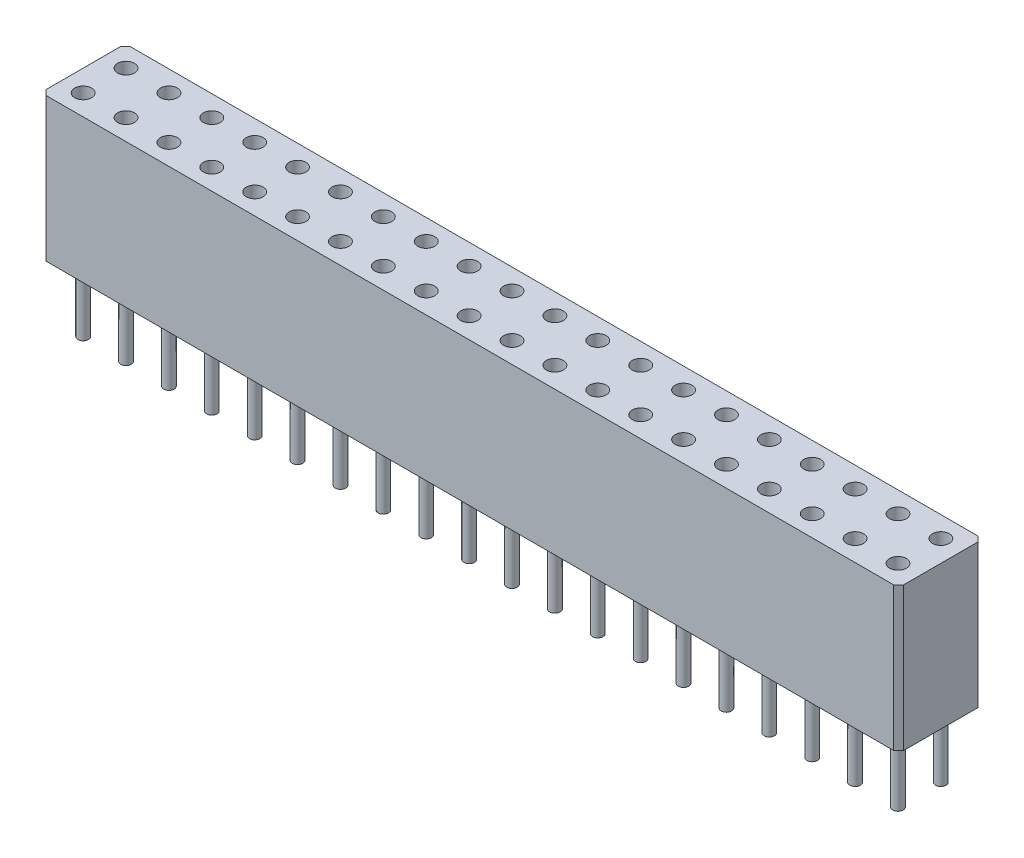
from build123d import *

# Parameters (mm, degrees)
SKETCH_2_R          = 0.31
EXTRUDE_4_DEPTH     = 8.5
SKETCH_7_R          = 0.5
CUT_EXTRUDE_1_DEPTH = 8
SKETCH_8_R          = 0.31
EXTRUDE_5_DEPTH     = 4
EXTRUDE_5_2_DEPTH   = 4
EXTRUDE_5_3_DEPTH   = 4
EXTRUDE_5_4_DEPTH   = 4
EXTRUDE_5_5_DEPTH   = 4
EXTRUDE_5_6_DEPTH   = 4
EXTRUDE_5_7_DEPTH   = 4
EXTRUDE_5_8_DEPTH   = 4
EXTRUDE_5_9_DEPTH   = 4
EXTRUDE_5_10_DEPTH  = 4
EXTRUDE_5_11_DEPTH  = 4
EXTRUDE_5_12_DEPTH  = 4
EXTRUDE_5_13_DEPTH  = 4
EXTRUDE_5_14_DEPTH  = 4
EXTRUDE_5_15_DEPTH  = 4
EXTRUDE_5_16_DEPTH  = 4
EXTRUDE_5_17_DEPTH  = 4
EXTRUDE_5_18_DEPTH  = 4
EXTRUDE_5_19_DEPTH  = 4
EXTRUDE_5_20_DEPTH  = 4
EXTRUDE_5_21_DEPTH  = 4
EXTRUDE_5_22_DEPTH  = 4
EXTRUDE_5_23_DEPTH  = 4
EXTRUDE_5_24_DEPTH  = 4
EXTRUDE_5_25_DEPTH  = 4
EXTRUDE_5_26_DEPTH  = 4
EXTRUDE_5_27_DEPTH  = 4
EXTRUDE_5_28_DEPTH  = 4
EXTRUDE_5_29_DEPTH  = 4
EXTRUDE_5_30_DEPTH  = 4
EXTRUDE_5_31_DEPTH  = 4
EXTRUDE_5_32_DEPTH  = 4
EXTRUDE_5_33_DEPTH  = 4
EXTRUDE_5_34_DEPTH  = 4
EXTRUDE_5_35_DEPTH  = 4
EXTRUDE_5_36_DEPTH  = 4
EXTRUDE_5_37_DEPTH  = 4
EXTRUDE_5_38_DEPTH  = 4
EXTRUDE_5_39_DEPTH  = 4
EXTRUDE_5_40_DEPTH  = 4


with BuildPart() as part:
    # Эскиз2 → Бобышка-Вытянуть4 (new body)
    with BuildSketch(Plane(origin=(0, 0, 0), x_dir=(1, 0, 0), z_dir=(0, 1, 0))):
        Polygon((49.411742563, 15.04372655), (86.911742563, 15.04372655), (87.211742563, 14.74372655), (87.211742563, 10.34372655), (86.911742563, 10.04372655), (49.411742563, 10.04372655), (36.711742563, 10.04372655), (36.411742563, 10.34372655), (36.411742563, 14.74372655), (36.711742563, 15.04372655), align=None)
        with Locations(Location((83.401742563, 11.27372655, 0), (0, 0, 270))):
            Circle(SKETCH_2_R, mode=Mode.SUBTRACT)
        with Locations(Location((80.861742563, 11.27372655, 0), (0, 0, 270))):
            Circle(SKETCH_2_R, mode=Mode.SUBTRACT)
        with Locations(Location((78.321742563, 11.27372655, 0), (0, 0, 270))):
            Circle(SKETCH_2_R, mode=Mode.SUBTRACT)
        with Locations(Location((75.781742563, 11.27372655, 0), (0, 0, 270))):
            Circle(SKETCH_2_R, mode=Mode.SUBTRACT)
        with Locations(Location((73.241742563, 11.27372655, 0), (0, 0, 270))):
            Circle(SKETCH_2_R, mode=Mode.SUBTRACT)
        with Locations(Location((70.701742563, 11.27372655, 0), (0, 0, 270))):
            Circle(SKETCH_2_R, mode=Mode.SUBTRACT)
        with Locations(Location((68.161742563, 11.27372655, 0), (0, 0, 270))):
            Circle(SKETCH_2_R, mode=Mode.SUBTRACT)
        with Locations(Location((65.621742563, 11.27372655, 0), (0, 0, 270))):
            Circle(SKETCH_2_R, mode=Mode.SUBTRACT)
        with Locations(Location((63.081742563, 11.27372655, 0), (0, 0, 270))):
            Circle(SKETCH_2_R, mode=Mode.SUBTRACT)
        with Locations(Location((60.541742563, 11.27372655, 0), (0, 0, 270))):
            Circle(SKETCH_2_R, mode=Mode.SUBTRACT)
        with Locations(Location((58.001742563, 11.27372655, 0), (0, 0, 270))):
            Circle(SKETCH_2_R, mode=Mode.SUBTRACT)
        with Locations(Location((55.461742563, 11.27372655, 0), (0, 0, 270))):
            Circle(SKETCH_2_R, mode=Mode.SUBTRACT)
        with Locations(Location((52.921742563, 11.27372655, 0), (0, 0, 270))):
            Circle(SKETCH_2_R, mode=Mode.SUBTRACT)
        with Locations(Location((50.381742563, 11.27372655, 0), (0, 0, 270))):
            Circle(SKETCH_2_R, mode=Mode.SUBTRACT)
        with Locations(Location((47.841742563, 11.27372655, 0), (0, 0, 270))):
            Circle(SKETCH_2_R, mode=Mode.SUBTRACT)
        with Locations(Location((45.301742563, 11.27372655, 0), (0, 0, 270))):
            Circle(SKETCH_2_R, mode=Mode.SUBTRACT)
        with Locations(Location((42.761742563, 11.27372655, 0), (0, 0, 270))):
            Circle(SKETCH_2_R, mode=Mode.SUBTRACT)
        with Locations(Location((40.221742563, 11.27372655, 0), (0, 0, 270))):
            Circle(SKETCH_2_R, mode=Mode.SUBTRACT)
        with Locations(Location((37.681742563, 11.27372655, 0), (0, 0, 270))):
            Circle(SKETCH_2_R, mode=Mode.SUBTRACT)
        with Locations(Location((83.401742563, 13.81372655, 0), (0, 0, 270))):
            Circle(SKETCH_2_R, mode=Mode.SUBTRACT)
        with Locations(Location((80.861742563, 13.81372655, 0), (0, 0, 270))):
            Circle(SKETCH_2_R, mode=Mode.SUBTRACT)
        with Locations(Location((78.321742563, 13.81372655, 0), (0, 0, 270))):
            Circle(SKETCH_2_R, mode=Mode.SUBTRACT)
        with Locations(Location((75.781742563, 13.81372655, 0), (0, 0, 270))):
            Circle(SKETCH_2_R, mode=Mode.SUBTRACT)
        with Locations(Location((73.241742563, 13.81372655, 0), (0, 0, 270))):
            Circle(SKETCH_2_R, mode=Mode.SUBTRACT)
        with Locations(Location((70.701742563, 13.81372655, 0), (0, 0, 270))):
            Circle(SKETCH_2_R, mode=Mode.SUBTRACT)
        with Locations(Location((68.161742563, 13.81372655, 0), (0, 0, 270))):
            Circle(SKETCH_2_R, mode=Mode.SUBTRACT)
        with Locations(Location((65.621742563, 13.81372655, 0), (0, 0, 270))):
            Circle(SKETCH_2_R, mode=Mode.SUBTRACT)
        with Locations(Location((63.081742563, 13.81372655, 0), (0, 0, 270))):
            Circle(SKETCH_2_R, mode=Mode.SUBTRACT)
        with Locations(Location((60.541742563, 13.81372655, 0), (0, 0, 270))):
            Circle(SKETCH_2_R, mode=Mode.SUBTRACT)
        with Locations(Location((85.941742563, 11.27372655, 0), (0, 0, 270))):
            Circle(SKETCH_2_R, mode=Mode.SUBTRACT)
        with Locations(Location((58.001742563, 13.81372655, 0), (0, 0, 270))):
            Circle(SKETCH_2_R, mode=Mode.SUBTRACT)
        with Locations(Location((55.461742563, 13.81372655, 0), (0, 0, 270))):
            Circle(SKETCH_2_R, mode=Mode.SUBTRACT)
        with Locations(Location((52.921742563, 13.81372655, 0), (0, 0, 270))):
            Circle(SKETCH_2_R, mode=Mode.SUBTRACT)
        with Locations(Location((50.381742563, 13.81372655, 0), (0, 0, 270))):
            Circle(SKETCH_2_R, mode=Mode.SUBTRACT)
        with Locations(Location((47.841742563, 13.81372655, 0), (0, 0, 270))):
            Circle(SKETCH_2_R, mode=Mode.SUBTRACT)
        with Locations(Location((45.301742563, 13.81372655, 0), (0, 0, 270))):
            Circle(SKETCH_2_R, mode=Mode.SUBTRACT)
        with Locations(Location((42.761742563, 13.81372655, 0), (0, 0, 270))):
            Circle(SKETCH_2_R, mode=Mode.SUBTRACT)
        with Locations(Location((40.221742563, 13.81372655, 0), (0, 0, 270))):
            Circle(SKETCH_2_R, mode=Mode.SUBTRACT)
        with Locations(Location((37.681742563, 13.81372655, 0), (0, 0, 270))):
            Circle(SKETCH_2_R, mode=Mode.SUBTRACT)
        with Locations(Location((85.941742563, 13.81372655, 0), (0, 0, 270))):
            Circle(SKETCH_2_R, mode=Mode.SUBTRACT)
    extrude(amount=-EXTRUDE_4_DEPTH)

    # Эскиз7 → Вырез-Вытянуть1 (cut)
    with BuildSketch(Plane(origin=(0, 0, 0), x_dir=(1, 0, 0), z_dir=(0, 1, 0))):
        with Locations(Location((83.401742563, 11.27372655, 0), (0, 0, 270))):
            Circle(SKETCH_7_R)
        with Locations(Location((80.861742563, 11.27372655, 0), (0, 0, 270))):
            Circle(SKETCH_7_R)
        with Locations(Location((78.321742563, 11.27372655, 0), (0, 0, 270))):
            Circle(SKETCH_7_R)
        with Locations(Location((75.781742563, 11.27372655, 0), (0, 0, 270))):
            Circle(SKETCH_7_R)
        with Locations(Location((73.241742563, 11.27372655, 0), (0, 0, 270))):
            Circle(SKETCH_7_R)
        with Locations(Location((70.701742563, 11.27372655, 0), (0, 0, 270))):
            Circle(SKETCH_7_R)
        with Locations(Location((68.161742563, 11.27372655, 0), (0, 0, 270))):
            Circle(SKETCH_7_R)
        with Locations(Location((65.621742563, 11.27372655, 0), (0, 0, 270))):
            Circle(SKETCH_7_R)
        with Locations(Location((63.081742563, 11.27372655, 0), (0, 0, 270))):
            Circle(SKETCH_7_R)
        with Locations(Location((60.541742563, 11.27372655, 0), (0, 0, 270))):
            Circle(SKETCH_7_R)
        with Locations(Location((58.001742563, 11.27372655, 0), (0, 0, 270))):
            Circle(SKETCH_7_R)
        with Locations(Location((55.461742563, 11.27372655, 0), (0, 0, 270))):
            Circle(SKETCH_7_R)
        with Locations(Location((52.921742563, 11.27372655, 0), (0, 0, 270))):
            Circle(SKETCH_7_R)
        with Locations(Location((50.381742563, 11.27372655, 0), (0, 0, 270))):
            Circle(SKETCH_7_R)
        with Locations(Location((47.841742563, 11.27372655, 0), (0, 0, 270))):
            Circle(SKETCH_7_R)
        with Locations(Location((45.301742563, 11.27372655, 0), (0, 0, 270))):
            Circle(SKETCH_7_R)
        with Locations(Location((42.761742563, 11.27372655, 0), (0, 0, 270))):
            Circle(SKETCH_7_R)
        with Locations(Location((40.221742563, 11.27372655, 0), (0, 0, 270))):
            Circle(SKETCH_7_R)
        with Locations(Location((37.681742563, 11.27372655, 0), (0, 0, 270))):
            Circle(SKETCH_7_R)
        with Locations(Location((83.401742563, 13.81372655, 0), (0, 0, 270))):
            Circle(SKETCH_7_R)
        with Locations(Location((80.861742563, 13.81372655, 0), (0, 0, 270))):
            Circle(SKETCH_7_R)
        with Locations(Location((78.321742563, 13.81372655, 0), (0, 0, 270))):
            Circle(SKETCH_7_R)
        with Locations(Location((75.781742563, 13.81372655, 0), (0, 0, 270))):
            Circle(SKETCH_7_R)
        with Locations(Location((73.241742563, 13.81372655, 0), (0, 0, 270))):
            Circle(SKETCH_7_R)
        with Locations(Location((70.701742563, 13.81372655, 0), (0, 0, 270))):
            Circle(SKETCH_7_R)
        with Locations(Location((68.161742563, 13.81372655, 0), (0, 0, 270))):
            Circle(SKETCH_7_R)
        with Locations(Location((65.621742563, 13.81372655, 0), (0, 0, 270))):
            Circle(SKETCH_7_R)
        with Locations(Location((63.081742563, 13.81372655, 0), (0, 0, 270))):
            Circle(SKETCH_7_R)
        with Locations(Location((60.541742563, 13.81372655, 0), (0, 0, 270))):
            Circle(SKETCH_7_R)
        with Locations(Location((85.941742563, 11.27372655, 0), (0, 0, 270))):
            Circle(SKETCH_7_R)
        with Locations(Location((58.001742563, 13.81372655, 0), (0, 0, 270))):
            Circle(SKETCH_7_R)
        with Locations(Location((55.461742563, 13.81372655, 0), (0, 0, 270))):
            Circle(SKETCH_7_R)
        with Locations(Location((52.921742563, 13.81372655, 0), (0, 0, 270))):
            Circle(SKETCH_7_R)
        with Locations(Location((50.381742563, 13.81372655, 0), (0, 0, 270))):
            Circle(SKETCH_7_R)
        with Locations(Location((47.841742563, 13.81372655, 0), (0, 0, 270))):
            Circle(SKETCH_7_R)
        with Locations(Location((45.301742563, 13.81372655, 0), (0, 0, 270))):
            Circle(SKETCH_7_R)
        with Locations(Location((42.761742563, 13.81372655, 0), (0, 0, 270))):
            Circle(SKETCH_7_R)
        with Locations(Location((40.221742563, 13.81372655, 0), (0, 0, 270))):
            Circle(SKETCH_7_R)
        with Locations(Location((37.681742563, 13.81372655, 0), (0, 0, 270))):
            Circle(SKETCH_7_R)
        with Locations(Location((85.941742563, 13.81372655, 0), (0, 0, 270))):
            Circle(SKETCH_7_R)
    extrude(amount=-CUT_EXTRUDE_1_DEPTH, mode=Mode.SUBTRACT)


with BuildPart() as body_2:
    # Эскиз8 → Бобышка-Вытянуть5 (new body)
    with BuildSketch(Plane.XZ.offset(8.5)):
        with Locations(Location((37.681742563, -11.27372655, 0), (0, 0, 270))):
            Circle(SKETCH_8_R)
    extrude(amount=EXTRUDE_5_DEPTH)


with BuildPart() as body_3:
    # Эскиз8 → Extrude 5 2 (new body)
    with BuildSketch(Plane.XZ.offset(8.5)):
        with Locations(Location((40.221742563, -11.27372655, 0), (0, 0, 270))):
            Circle(SKETCH_8_R)
    extrude(amount=EXTRUDE_5_2_DEPTH)


with BuildPart() as body_4:
    # Эскиз8 → Extrude 5 3 (new body)
    with BuildSketch(Plane.XZ.offset(8.5)):
        with Locations(Location((42.761742563, -11.27372655, 0), (0, 0, 270))):
            Circle(SKETCH_8_R)
    extrude(amount=EXTRUDE_5_3_DEPTH)


with BuildPart() as body_5:
    # Эскиз8 → Extrude 5 4 (new body)
    with BuildSketch(Plane.XZ.offset(8.5)):
        with Locations(Location((45.301742563, -11.27372655, 0), (0, 0, 270))):
            Circle(SKETCH_8_R)
    extrude(amount=EXTRUDE_5_4_DEPTH)


with BuildPart() as body_6:
    # Эскиз8 → Extrude 5 5 (new body)
    with BuildSketch(Plane.XZ.offset(8.5)):
        with Locations(Location((47.841742563, -11.27372655, 0), (0, 0, 270))):
            Circle(SKETCH_8_R)
    extrude(amount=EXTRUDE_5_5_DEPTH)


with BuildPart() as body_7:
    # Эскиз8 → Extrude 5 6 (new body)
    with BuildSketch(Plane.XZ.offset(8.5)):
        with Locations(Location((50.381742563, -11.27372655, 0), (0, 0, 270))):
            Circle(SKETCH_8_R)
    extrude(amount=EXTRUDE_5_6_DEPTH)


with BuildPart() as body_8:
    # Эскиз8 → Extrude 5 7 (new body)
    with BuildSketch(Plane.XZ.offset(8.5)):
        with Locations(Location((52.921742563, -11.27372655, 0), (0, 0, 270))):
            Circle(SKETCH_8_R)
    extrude(amount=EXTRUDE_5_7_DEPTH)


with BuildPart() as body_9:
    # Эскиз8 → Extrude 5 8 (new body)
    with BuildSketch(Plane.XZ.offset(8.5)):
        with Locations(Location((55.461742563, -11.27372655, 0), (0, 0, 270))):
            Circle(SKETCH_8_R)
    extrude(amount=EXTRUDE_5_8_DEPTH)


with BuildPart() as body_10:
    # Эскиз8 → Extrude 5 9 (new body)
    with BuildSketch(Plane.XZ.offset(8.5)):
        with Locations(Location((58.001742563, -11.27372655, 0), (0, 0, 270))):
            Circle(SKETCH_8_R)
    extrude(amount=EXTRUDE_5_9_DEPTH)


with BuildPart() as body_11:
    # Эскиз8 → Extrude 5 10 (new body)
    with BuildSketch(Plane.XZ.offset(8.5)):
        with Locations(Location((60.541742563, -11.27372655, 0), (0, 0, 270))):
            Circle(SKETCH_8_R)
    extrude(amount=EXTRUDE_5_10_DEPTH)


with BuildPart() as body_12:
    # Эскиз8 → Extrude 5 11 (new body)
    with BuildSketch(Plane.XZ.offset(8.5)):
        with Locations(Location((63.081742563, -11.27372655, 0), (0, 0, 270))):
            Circle(SKETCH_8_R)
    extrude(amount=EXTRUDE_5_11_DEPTH)


with BuildPart() as body_13:
    # Эскиз8 → Extrude 5 12 (new body)
    with BuildSketch(Plane.XZ.offset(8.5)):
        with Locations(Location((65.621742563, -11.27372655, 0), (0, 0, 270))):
            Circle(SKETCH_8_R)
    extrude(amount=EXTRUDE_5_12_DEPTH)


with BuildPart() as body_14:
    # Эскиз8 → Extrude 5 13 (new body)
    with BuildSketch(Plane.XZ.offset(8.5)):
        with Locations(Location((68.161742563, -11.27372655, 0), (0, 0, 270))):
            Circle(SKETCH_8_R)
    extrude(amount=EXTRUDE_5_13_DEPTH)


with BuildPart() as body_15:
    # Эскиз8 → Extrude 5 14 (new body)
    with BuildSketch(Plane.XZ.offset(8.5)):
        with Locations(Location((70.701742563, -11.27372655, 0), (0, 0, 270))):
            Circle(SKETCH_8_R)
    extrude(amount=EXTRUDE_5_14_DEPTH)


with BuildPart() as body_16:
    # Эскиз8 → Extrude 5 15 (new body)
    with BuildSketch(Plane.XZ.offset(8.5)):
        with Locations(Location((73.241742563, -11.27372655, 0), (0, 0, 270))):
            Circle(SKETCH_8_R)
    extrude(amount=EXTRUDE_5_15_DEPTH)


with BuildPart() as body_17:
    # Эскиз8 → Extrude 5 16 (new body)
    with BuildSketch(Plane.XZ.offset(8.5)):
        with Locations(Location((75.781742563, -11.27372655, 0), (0, 0, 270))):
            Circle(SKETCH_8_R)
    extrude(amount=EXTRUDE_5_16_DEPTH)


with BuildPart() as body_18:
    # Эскиз8 → Extrude 5 17 (new body)
    with BuildSketch(Plane.XZ.offset(8.5)):
        with Locations(Location((78.321742563, -11.27372655, 0), (0, 0, 270))):
            Circle(SKETCH_8_R)
    extrude(amount=EXTRUDE_5_17_DEPTH)


with BuildPart() as body_19:
    # Эскиз8 → Extrude 5 18 (new body)
    with BuildSketch(Plane.XZ.offset(8.5)):
        with Locations(Location((80.861742563, -11.27372655, 0), (0, 0, 270))):
            Circle(SKETCH_8_R)
    extrude(amount=EXTRUDE_5_18_DEPTH)


with BuildPart() as body_20:
    # Эскиз8 → Extrude 5 19 (new body)
    with BuildSketch(Plane.XZ.offset(8.5)):
        with Locations(Location((83.401742563, -11.27372655, 0), (0, 0, 270))):
            Circle(SKETCH_8_R)
    extrude(amount=EXTRUDE_5_19_DEPTH)


with BuildPart() as body_21:
    # Эскиз8 → Extrude 5 20 (new body)
    with BuildSketch(Plane.XZ.offset(8.5)):
        with Locations(Location((85.941742563, -11.27372655, 0), (0, 0, 270))):
            Circle(SKETCH_8_R)
    extrude(amount=EXTRUDE_5_20_DEPTH)


with BuildPart() as body_22:
    # Эскиз8 → Extrude 5 21 (new body)
    with BuildSketch(Plane.XZ.offset(8.5)):
        with Locations(Location((40.221742563, -13.81372655, 0), (0, 0, 270))):
            Circle(SKETCH_8_R)
    extrude(amount=EXTRUDE_5_21_DEPTH)


with BuildPart() as body_23:
    # Эскиз8 → Extrude 5 22 (new body)
    with BuildSketch(Plane.XZ.offset(8.5)):
        with Locations(Location((42.761742563, -13.81372655, 0), (0, 0, 270))):
            Circle(SKETCH_8_R)
    extrude(amount=EXTRUDE_5_22_DEPTH)


with BuildPart() as body_24:
    # Эскиз8 → Extrude 5 23 (new body)
    with BuildSketch(Plane.XZ.offset(8.5)):
        with Locations(Location((45.301742563, -13.81372655, 0), (0, 0, 270))):
            Circle(SKETCH_8_R)
    extrude(amount=EXTRUDE_5_23_DEPTH)


with BuildPart() as body_25:
    # Эскиз8 → Extrude 5 24 (new body)
    with BuildSketch(Plane.XZ.offset(8.5)):
        with Locations(Location((47.841742563, -13.81372655, 0), (0, 0, 270))):
            Circle(SKETCH_8_R)
    extrude(amount=EXTRUDE_5_24_DEPTH)


with BuildPart() as body_26:
    # Эскиз8 → Extrude 5 25 (new body)
    with BuildSketch(Plane.XZ.offset(8.5)):
        with Locations(Location((50.381742563, -13.81372655, 0), (0, 0, 270))):
            Circle(SKETCH_8_R)
    extrude(amount=EXTRUDE_5_25_DEPTH)


with BuildPart() as body_27:
    # Эскиз8 → Extrude 5 26 (new body)
    with BuildSketch(Plane.XZ.offset(8.5)):
        with Locations(Location((52.921742563, -13.81372655, 0), (0, 0, 270))):
            Circle(SKETCH_8_R)
    extrude(amount=EXTRUDE_5_26_DEPTH)


with BuildPart() as body_28:
    # Эскиз8 → Extrude 5 27 (new body)
    with BuildSketch(Plane.XZ.offset(8.5)):
        with Locations(Location((55.461742563, -13.81372655, 0), (0, 0, 270))):
            Circle(SKETCH_8_R)
    extrude(amount=EXTRUDE_5_27_DEPTH)


with BuildPart() as body_29:
    # Эскиз8 → Extrude 5 28 (new body)
    with BuildSketch(Plane.XZ.offset(8.5)):
        with Locations(Location((58.001742563, -13.81372655, 0), (0, 0, 270))):
            Circle(SKETCH_8_R)
    extrude(amount=EXTRUDE_5_28_DEPTH)


with BuildPart() as body_30:
    # Эскиз8 → Extrude 5 29 (new body)
    with BuildSketch(Plane.XZ.offset(8.5)):
        with Locations(Location((60.541742563, -13.81372655, 0), (0, 0, 270))):
            Circle(SKETCH_8_R)
    extrude(amount=EXTRUDE_5_29_DEPTH)


with BuildPart() as body_31:
    # Эскиз8 → Extrude 5 30 (new body)
    with BuildSketch(Plane.XZ.offset(8.5)):
        with Locations(Location((63.081742563, -13.81372655, 0), (0, 0, 270))):
            Circle(SKETCH_8_R)
    extrude(amount=EXTRUDE_5_30_DEPTH)


with BuildPart() as body_32:
    # Эскиз8 → Extrude 5 31 (new body)
    with BuildSketch(Plane.XZ.offset(8.5)):
        with Locations(Location((65.621742563, -13.81372655, 0), (0, 0, 270))):
            Circle(SKETCH_8_R)
    extrude(amount=EXTRUDE_5_31_DEPTH)


with BuildPart() as body_33:
    # Эскиз8 → Extrude 5 32 (new body)
    with BuildSketch(Plane.XZ.offset(8.5)):
        with Locations(Location((68.161742563, -13.81372655, 0), (0, 0, 270))):
            Circle(SKETCH_8_R)
    extrude(amount=EXTRUDE_5_32_DEPTH)


with BuildPart() as body_34:
    # Эскиз8 → Extrude 5 33 (new body)
    with BuildSketch(Plane.XZ.offset(8.5)):
        with Locations(Location((70.701742563, -13.81372655, 0), (0, 0, 270))):
            Circle(SKETCH_8_R)
    extrude(amount=EXTRUDE_5_33_DEPTH)


with BuildPart() as body_35:
    # Эскиз8 → Extrude 5 34 (new body)
    with BuildSketch(Plane.XZ.offset(8.5)):
        with Locations(Location((73.241742563, -13.81372655, 0), (0, 0, 270))):
            Circle(SKETCH_8_R)
    extrude(amount=EXTRUDE_5_34_DEPTH)


with BuildPart() as body_36:
    # Эскиз8 → Extrude 5 35 (new body)
    with BuildSketch(Plane.XZ.offset(8.5)):
        with Locations(Location((75.781742563, -13.81372655, 0), (0, 0, 270))):
            Circle(SKETCH_8_R)
    extrude(amount=EXTRUDE_5_35_DEPTH)


with BuildPart() as body_37:
    # Эскиз8 → Extrude 5 36 (new body)
    with BuildSketch(Plane.XZ.offset(8.5)):
        with Locations(Location((78.321742563, -13.81372655, 0), (0, 0, 270))):
            Circle(SKETCH_8_R)
    extrude(amount=EXTRUDE_5_36_DEPTH)


with BuildPart() as body_38:
    # Эскиз8 → Extrude 5 37 (new body)
    with BuildSketch(Plane.XZ.offset(8.5)):
        with Locations(Location((80.861742563, -13.81372655, 0), (0, 0, 270))):
            Circle(SKETCH_8_R)
    extrude(amount=EXTRUDE_5_37_DEPTH)


with BuildPart() as body_39:
    # Эскиз8 → Extrude 5 38 (new body)
    with BuildSketch(Plane.XZ.offset(8.5)):
        with Locations(Location((83.401742563, -13.81372655, 0), (0, 0, 270))):
            Circle(SKETCH_8_R)
    extrude(amount=EXTRUDE_5_38_DEPTH)


with BuildPart() as body_40:
    # Эскиз8 → Extrude 5 39 (new body)
    with BuildSketch(Plane.XZ.offset(8.5)):
        with Locations(Location((85.941742563, -13.81372655, 0), (0, 0, 270))):
            Circle(SKETCH_8_R)
    extrude(amount=EXTRUDE_5_39_DEPTH)


with BuildPart() as body_41:
    # Эскиз8 → Extrude 5 40 (new body)
    with BuildSketch(Plane.XZ.offset(8.5)):
        with Locations(Location((37.681742563, -13.81372655, 0), (0, 0, 270))):
            Circle(SKETCH_8_R)
    extrude(amount=EXTRUDE_5_40_DEPTH)


solid = Compound([part.part, body_2.part, body_3.part, body_4.part, body_5.part, body_6.part, body_7.part, body_8.part, body_9.part, body_10.part, body_11.part, body_12.part, body_13.part, body_14.part, body_15.part, body_16.part, body_17.part, body_18.part, body_19.part, body_20.part, body_21.part, body_22.part, body_23.part, body_24.part, body_25.part, body_26.part, body_27.part, body_28.part, body_29.part, body_30.part, body_31.part, body_32.part, body_33.part, body_34.part, body_35.part, body_36.part, body_37.part, body_38.part, body_39.part, body_40.part, body_41.part])
